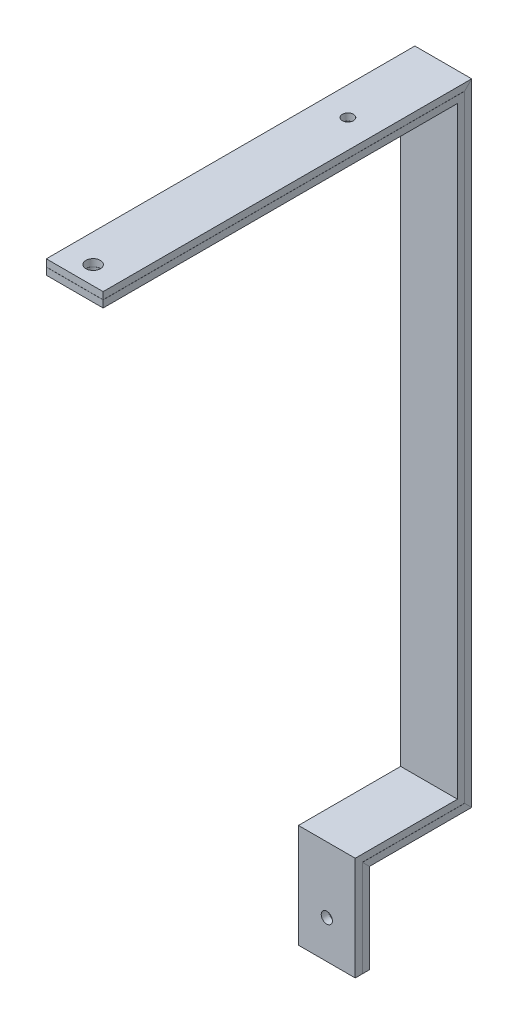
from build123d import *

# Parameters (mm, degrees)
CROQUIS1_W              = 50.8
CROQUIS1_H              = 6.31
SALIENTE_EXTRUIR1_DEPTH = 50.8
CROQUIS4_R              = 5
CORTAR_EXTRUIR2_DEPTH   = 40
CROQUIS6_R              = 6.5
CORTAR_EXTRUIR4_DEPTH   = 50
CROQUIS7_R              = 5
CORTAR_EXTRUIR5_DEPTH   = 26


with BuildPart() as part:
    # Barrer1: sweep along a curve in space
    with BuildLine() as barrer1_path:
        Line((0, 0, 0), (0, 0, -326.34))
        Line((0, 0, -326.34), (0, -557.76, -326.34))
        Line((0, -557.76, -326.34), (0, -557.76, -234.936165))
        Line((0, -557.76, -234.936165), (0, -640.92, -234.936165))
    # Croquis1 → Barrer1 (sweep)
    with BuildSketch(Plane.XY):
        Rectangle(CROQUIS1_W, CROQUIS1_H)
    sweep(path=barrer1_path.line, transition=Transition.RIGHT)


with BuildPart() as body_2:
    # Croquis2 → Saliente-Extruir1 (new body)
    with BuildSketch(Plane(origin=(25.4, 0, 0), x_dir=(0, 0, -1), z_dir=(1, 0, 0))):
        Polygon((0, -3.255), (323.085, -3.255), (323.085, -554.505), (231.681165, -554.505), (231.681165, -640.92), (225.371165, -640.92), (225.371165, -548.195), (316.775, -548.195), (316.775, -9.565), (0, -9.565), align=None)
    extrude(amount=-SALIENTE_EXTRUIR1_DEPTH)


with BuildPart() as cortar_extruir2_tool:
    # Croquis4 → Cortar-Extruir2 (new body)
    with BuildSketch(Plane(origin=(0, 3.155, 0), x_dir=(1, 0, 0), z_dir=(0, 1, 0))):
        with Locations(Location((0, 244.195, 0), (0, 0, 270))):
            Circle(CROQUIS4_R)
    extrude(amount=-CORTAR_EXTRUIR2_DEPTH)


with BuildPart() as part_1:
    add(part.part)

    # Cortar-Extruir2: cut by cortar_extruir2_tool
    add(cortar_extruir2_tool.part, mode=Mode.SUBTRACT)


with BuildPart() as body_2_1:
    add(body_2.part)

    # Cortar-Extruir2: cut by cortar_extruir2_tool
    add(cortar_extruir2_tool.part, mode=Mode.SUBTRACT)


with BuildPart() as cortar_extruir4_tool:
    # Croquis6 → Cortar-Extruir4 (new body)
    with BuildSketch(Plane(origin=(0, 3.155, 0), x_dir=(1, 0, 0), z_dir=(0, 1, 0))):
        with Locations(Location((0, 16.5, 0), (0, 0, 270))):
            Circle(CROQUIS6_R)
    extrude(amount=-CORTAR_EXTRUIR4_DEPTH)


with BuildPart() as part_2:
    add(part_1.part)

    # Cortar-Extruir4: cut by cortar_extruir4_tool
    add(cortar_extruir4_tool.part, mode=Mode.SUBTRACT)


with BuildPart() as body_2_2:
    add(body_2_1.part)

    # Cortar-Extruir4: cut by cortar_extruir4_tool
    add(cortar_extruir4_tool.part, mode=Mode.SUBTRACT)


with BuildPart() as cortar_extruir5_tool:
    # Croquis7 → Cortar-Extruir5 (new body)
    with BuildSketch(Plane.XY.offset(-225.371165)):
        with Locations((0, -606.92)):
            Circle(CROQUIS7_R)
    extrude(amount=-CORTAR_EXTRUIR5_DEPTH)


with BuildPart() as part_3:
    add(part_2.part)

    # Cortar-Extruir5: cut by cortar_extruir5_tool
    add(cortar_extruir5_tool.part, mode=Mode.SUBTRACT)


with BuildPart() as body_2_3:
    add(body_2_2.part)

    # Cortar-Extruir5: cut by cortar_extruir5_tool
    add(cortar_extruir5_tool.part, mode=Mode.SUBTRACT)


solid = Compound([part_3.part, body_2_3.part])
